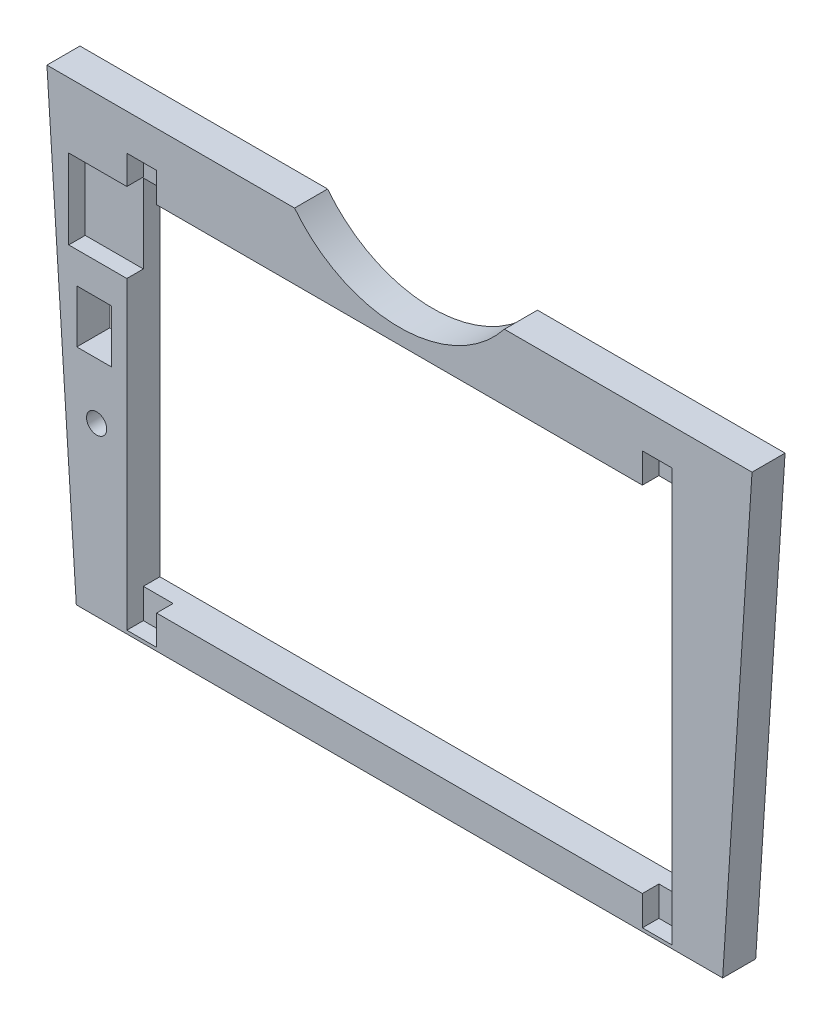
from build123d import *

# Parameters (mm, degrees)
SKETCH1_W           = 165
SKETCH1_H           = 107
BOSS_EXTRUDE1_DEPTH = 10
SKETCH2_W           = 9
SKETCH2_H           = 9
CUT_EXTRUDE1_DEPTH  = 5
SKETCH3_W           = 17.586391164
SKETCH3_H           = 24.095664715
CUT_EXTRUDE2_DEPTH  = 5
SKETCH6_W           = 10.5
SKETCH6_H           = 16
CUT_EXTRUDE3_DEPTH  = 130.934107916
SKETCH8_R           = 3.05
CUT_EXTRUDE4_DEPTH  = 130.934107916
SKETCH9_W           = 9
SKETCH9_H           = 9
CUT_EXTRUDE5_DEPTH  = 5


with BuildPart() as part:
    # Sketch1 → Boss-Extrude1 (new body)
    with BuildSketch(Plane.XY):
        with BuildLine():
            Line((-106.68, 73.5), (-31.75, 73.5))
            ThreePointArc((-31.75, 73.5), (0, 58.078932216), (31.75, 73.5))
            Line((31.75, 73.5), (106.68, 73.5))
            Line((106.68, 73.5), (97.79, -63.5))
            Line((97.79, -63.5), (-97.79, -63.5))
            Line((-97.79, -63.5), (-106.68, 73.5))
        make_face()
        Rectangle(SKETCH1_W, SKETCH1_H, mode=Mode.SUBTRACT)
    extrude(amount=BOSS_EXTRUDE1_DEPTH)

    # Sketch2 → Cut-Extrude1 (cut)
    with BuildSketch(Plane.XY.offset(10)):
        with Locations((78, 58)):
            Rectangle(SKETCH2_W, SKETCH2_H)
        with Locations((-78, 58)):
            Rectangle(SKETCH2_W, SKETCH2_H)
    extrude(amount=-CUT_EXTRUDE1_DEPTH, mode=Mode.SUBTRACT)

    # Sketch3 → Cut-Extrude2 (cut)
    with BuildSketch(Plane.XY.offset(10)):
        with Locations((-91.293195582, 41.716713566)):
            Rectangle(SKETCH3_W, SKETCH3_H)
    extrude(amount=-CUT_EXTRUDE2_DEPTH, mode=Mode.SUBTRACT)

    # Sketch6 → Cut-Extrude3 (cut, through all)
    with BuildSketch(Plane(origin=(0, 0, 0), x_dir=(-1, 0, 0), z_dir=(0, 0, -1))):
        with Locations((92.403067071, 12.157965544)):
            Rectangle(SKETCH6_W, SKETCH6_H)
    extrude(amount=-CUT_EXTRUDE3_DEPTH, mode=Mode.SUBTRACT)

    # Sketch8 → Cut-Extrude4 (cut, through all)
    with BuildSketch(Plane(origin=(0, 0, 0), x_dir=(-1, 0, 0), z_dir=(0, 0, -1))):
        with Locations((91.642033661, -12.875359706)):
            Circle(SKETCH8_R)
    extrude(amount=-CUT_EXTRUDE4_DEPTH, mode=Mode.SUBTRACT)

    # Sketch9 → Cut-Extrude5 (cut)
    with BuildSketch(Plane.XY.offset(10)):
        with Locations((78, -58)):
            Rectangle(SKETCH9_W, SKETCH9_H)
        with Locations((-78, -58)):
            Rectangle(SKETCH9_W, SKETCH9_H)
    extrude(amount=-CUT_EXTRUDE5_DEPTH, mode=Mode.SUBTRACT)


solid = part.part
